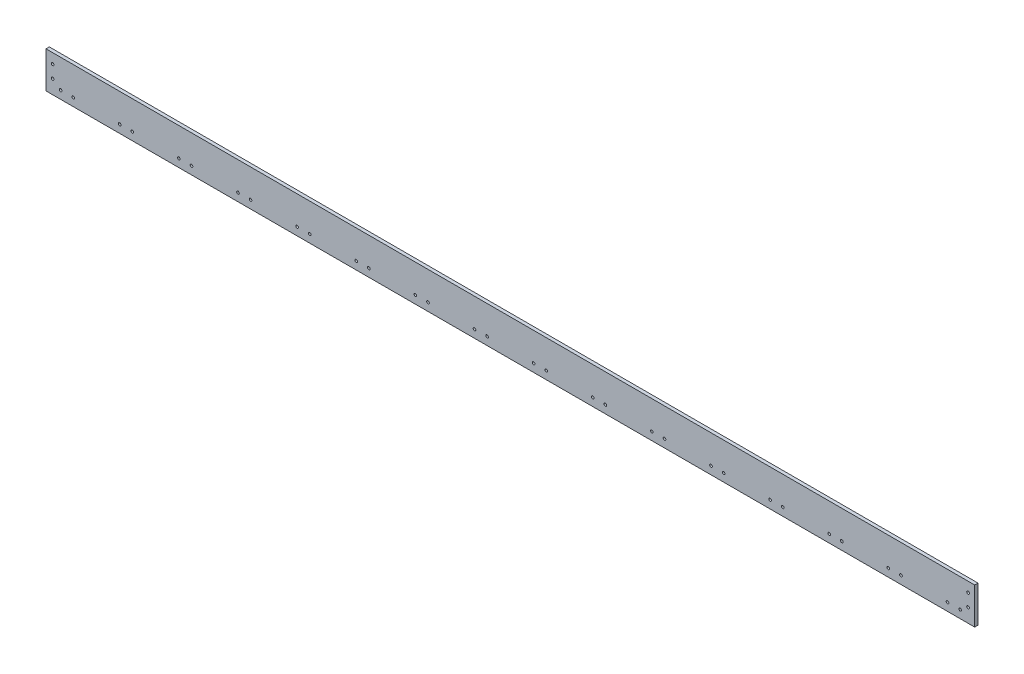
from build123d import *

# Parameters (mm, degrees)
SKETCH1_W           = 1778
SKETCH1_H           = 69.85
BOSS_EXTRUDE1_DEPTH = 6.35
SKETCH2_R           = 2.54
CUT_EXTRUDE1_DEPTH  = 6.35
SKETCH3_R           = 2.54
CUT_EXTRUDE2_DEPTH  = 6.35
LPATTERN2_COUNT     = 16
LPATTERN2_PITCH     = 113.199333333


with BuildPart() as part:
    # Sketch1 → Boss-Extrude1 (new body)
    with BuildSketch(Plane.XY):
        with Locations((889, 34.925)):
            Rectangle(SKETCH1_W, SKETCH1_H)
    extrude(amount=BOSS_EXTRUDE1_DEPTH)

    # Sketch2 → Cut-Extrude1 (cut)
    with BuildSketch(Plane.XY.offset(6.35)):
        with Locations((27.94, 15.24)):
            Circle(SKETCH2_R)
        with Locations((52.07, 15.24)):
            Circle(SKETCH2_R)
    cut_extrude1 = extrude(amount=-CUT_EXTRUDE1_DEPTH, mode=Mode.SUBTRACT)

    # Sketch3 → Cut-Extrude2 (cut)
    with BuildSketch(Plane.XY.offset(6.35)):
        with Locations((12.7, 26.67)):
            Circle(SKETCH3_R)
        with Locations((12.7, 50.8)):
            Circle(SKETCH3_R)
        with Locations(Location((1765.3, 26.67, 0), (0, 0, 180))):
            Circle(SKETCH3_R)
        with Locations(Location((1765.3, 50.8, 0), (0, 0, 180))):
            Circle(SKETCH3_R)
    extrude(amount=-CUT_EXTRUDE2_DEPTH, mode=Mode.SUBTRACT)

    # LPattern2: Cut-Extrude1 ×16
    with Locations(*[(i * LPATTERN2_PITCH, 0, 0) for i in range(1, LPATTERN2_COUNT)]):
        add(cut_extrude1, mode=Mode.SUBTRACT)


solid = part.part
